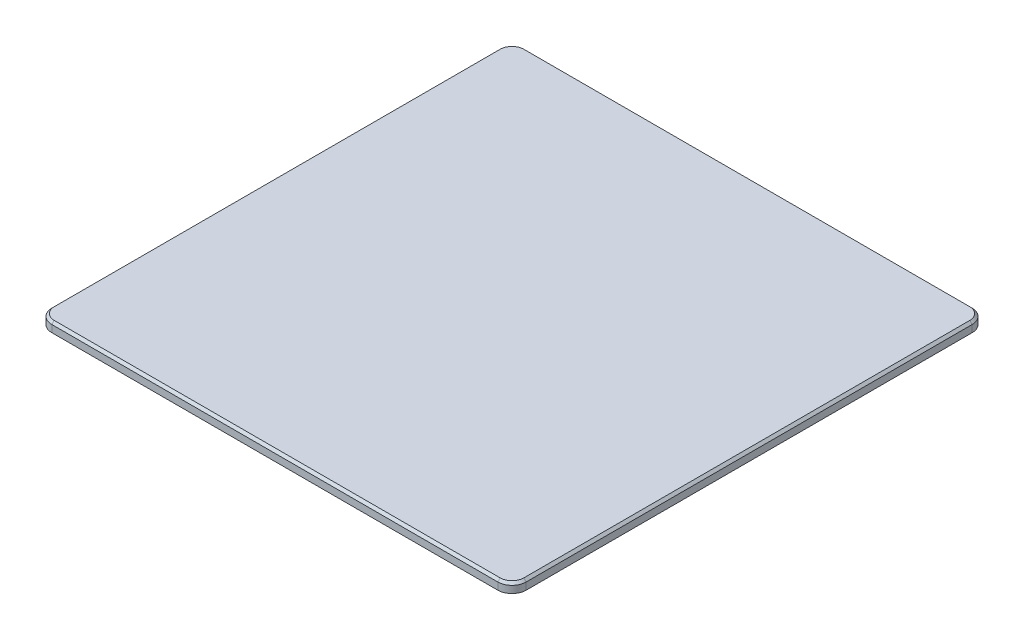
from build123d import *

# Parameters (mm, degrees)
EXTRUDE_1_DEPTH = 2
CHAMFER_1_SIZE  = 0.5


with BuildPart() as part:
    # 草图1 → 凸台-拉伸1 (new body)
    with BuildSketch(Plane(origin=(0, 0, 0), x_dir=(1, 0, 0), z_dir=(0, 1, 0))):
        with BuildLine():
            Line((-47, 50), (47, 50))
            ThreePointArc((47, 50), (49.121320344, 49.121320344), (50, 47))
            Line((50, 47), (50, -47))
            ThreePointArc((50, -47), (49.121320344, -49.121320344), (47, -50))
            Line((47, -50), (-47, -50))
            ThreePointArc((-47, -50), (-49.121320344, -49.121320344), (-50, -47))
            Line((-50, -47), (-50, 47))
            ThreePointArc((-50, 47), (-49.121320344, 49.121320344), (-47, 50))
        make_face()
    extrude(amount=EXTRUDE_1_DEPTH)

    # 倒角1
    chamfer_1_edges = [part.edges().sort_by_distance(p)[0] for p in [
        (-49.121320344, 2, -49.121320344),
        (-50, 2, 0),
        (-49.121320344, 2, 49.121320344),
        (0, 2, 50),
        (49.121320344, 2, 49.121320344),
        (50, 2, 0),
        (49.121320344, 2, -49.121320344),
        (0, 2, -50),
    ]]
    chamfer(chamfer_1_edges, length=CHAMFER_1_SIZE)


solid = part.part
